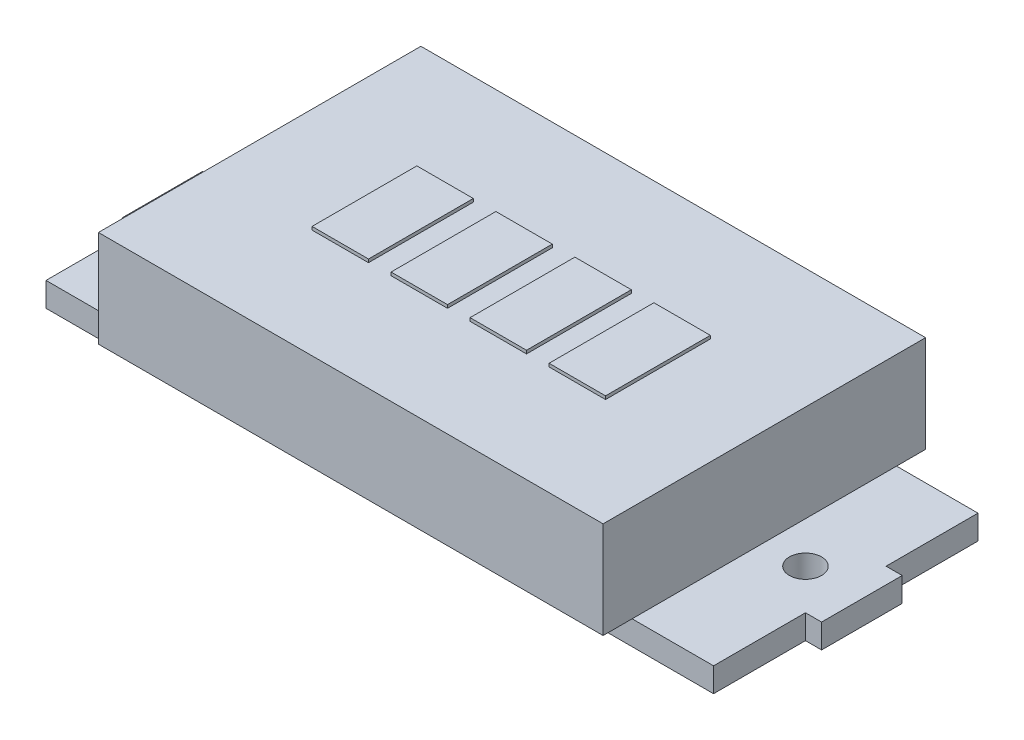
from build123d import *

# Parameters (mm, degrees)
SKETCH1_W             = 31.3
SKETCH1_H             = 20
BOSS_EXTRUDE1_DEPTH   = 6
SKETCH2_W             = 3.5
SKETCH2_H             = 6.5
BOSS_EXTRUDE2_DEPTH   = 0.2
BOSS_EXTRUDE2_2_DEPTH = 0.2
BOSS_EXTRUDE2_3_DEPTH = 0.2
BOSS_EXTRUDE2_4_DEPTH = 0.2
SKETCH3_W             = 41.4
SKETCH3_H             = 16.4
BOSS_EXTRUDE3_DEPTH   = 1.5
SKETCH4_W             = 43.4
SKETCH4_H             = 5
BOSS_EXTRUDE4_DEPTH   = 1.5
SKETCH5_R             = 1
CUT_EXTRUDE1_DEPTH    = 1.5
SKETCH6_W             = 4
SKETCH6_H             = 9
BOSS_EXTRUDE5_DEPTH   = 1.5


with BuildPart() as part:
    # Sketch1 → Boss-Extrude1 (new body)
    with BuildSketch(Plane(origin=(0, 0, 0), x_dir=(1, 0, 0), z_dir=(0, 1, 0))):
        with Locations((15.65, 10)):
            Rectangle(SKETCH1_W, SKETCH1_H)
    extrude(amount=BOSS_EXTRUDE1_DEPTH)



with BuildPart() as body_2:
    # Sketch2 → Boss-Extrude2 (new body)
    with BuildSketch(Plane.XZ.offset(-6)):
        with Locations((13.15, -10)):
            Rectangle(SKETCH2_W, SKETCH2_H)
    extrude(amount=-BOSS_EXTRUDE2_DEPTH)


with BuildPart() as body_3:
    # Sketch2 → Boss-Extrude2 2 (new body)
    with BuildSketch(Plane.XZ.offset(-6)):
        with Locations((8.25, -10)):
            Rectangle(SKETCH2_W, SKETCH2_H)
    extrude(amount=-BOSS_EXTRUDE2_2_DEPTH)


with BuildPart() as body_4:
    # Sketch2 → Boss-Extrude2 3 (new body)
    with BuildSketch(Plane.XZ.offset(-6)):
        with Locations((18.05, -10)):
            Rectangle(SKETCH2_W, SKETCH2_H)
    extrude(amount=-BOSS_EXTRUDE2_3_DEPTH)


with BuildPart() as body_5:
    # Sketch2 → Boss-Extrude2 4 (new body)
    with BuildSketch(Plane.XZ.offset(-6)):
        with Locations((22.95, -10)):
            Rectangle(SKETCH2_W, SKETCH2_H)
    extrude(amount=-BOSS_EXTRUDE2_4_DEPTH)


with BuildPart() as body_6:
    # Sketch3 → Boss-Extrude3 (new body)
    with BuildSketch(Plane.XZ):
        with Locations((15.65, -10)):
            Rectangle(SKETCH3_W, SKETCH3_H)
    extrude(amount=BOSS_EXTRUDE3_DEPTH)


with BuildPart() as part_1:
    add(part.part)

    add(body_6.part)  # Boss-Extrude4 merges body 6
    # Sketch4 → Boss-Extrude4 (add)
    with BuildSketch(Plane.XZ.offset(1.5)):
        with Locations((15.65, -10)):
            Rectangle(SKETCH4_W, SKETCH4_H)
    extrude(amount=-BOSS_EXTRUDE4_DEPTH)

    # Sketch5 → Cut-Extrude1 (cut)
    with BuildSketch(Plane.XZ.offset(1.5)):
        with Locations((-2.55, -10)):
            Circle(SKETCH5_R)
        with Locations((33.85, -10)):
            Circle(SKETCH5_R)
    extrude(amount=-CUT_EXTRUDE1_DEPTH, mode=Mode.SUBTRACT)


with BuildPart() as body_6_2:
    # Sketch6 → Boss-Extrude5 (new body)
    with BuildSketch(Plane.XZ.offset(1.5)):
        with Locations((25.35, -10)):
            Rectangle(SKETCH6_W, SKETCH6_H)
    extrude(amount=BOSS_EXTRUDE5_DEPTH)


solid = Compound([body_2.part, body_3.part, body_4.part, body_5.part, part_1.part, body_6_2.part])
